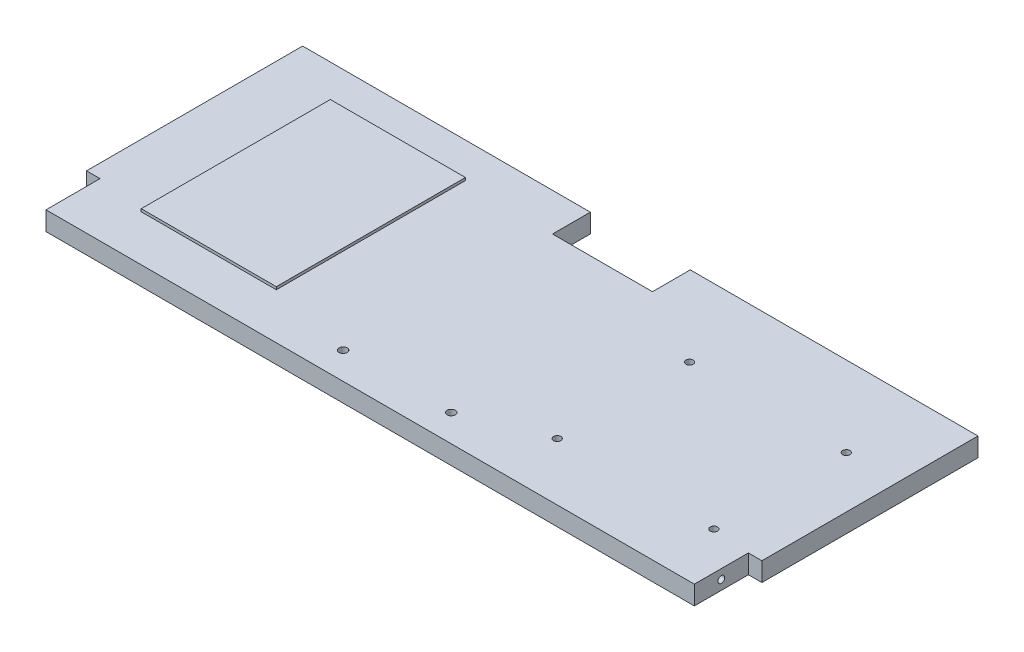
from build123d import *

# Parameters (mm, degrees)
SKIZZE1_W                             = 250
SKIZZE1_H                             = 250
AUFSATZ_LINEAR_AUSTRAGEN1_DEPTH       = 5
SKIZZE2_W                             = 40
SKIZZE2_H                             = 40
AUFSATZ_LINEAR_AUSTRAGEN2_DEPTH       = 15
SKIZZE3_R                             = 1.65
SKIZZE3_W                             = 30
SKIZZE3_H                             = 30
SCHNITT_LINEAR_AUSTRAGEN1_DEPTH       = 15
SKIZZE4_R                             = 1.65
SKIZZE4_W                             = 30
SKIZZE4_H                             = 30
SCHNITT_LINEAR_AUSTRAGEN2_DEPTH       = 15
SKIZZE6_W                             = 40
SKIZZE6_H                             = 40
AUFSATZ_LINEAR_AUSTRAGEN3_DEPTH       = 5
SKIZZE7_W                             = 40
SKIZZE7_H                             = 40
SCHNITT_LINEAR_AUSTRAGEN3_DEPTH       = 43
SKIZZE8_W                             = 30
SKIZZE8_H                             = 30
AUFSATZ_LINEAR_AUSTRAGEN4_DEPTH       = 5
SKIZZE9_W                             = 45
SKIZZE9_H                             = 45
AUFSATZ_LINEAR_AUSTRAGEN5_DEPTH       = 15
SKIZZE10_W                            = 8
SKIZZE10_H                            = 8
AUFSATZ_LINEAR_AUSTRAGEN6_DEPTH       = 34
SKIZZE11_R                            = 2.15
SCHNITT_LINEAR_AUSTRAGEN4_DEPTH       = 34
SKIZZE12_W                            = 143.062860871
SKIZZE12_H                            = 184.486429343
SCHNITT_LINEAR_AUSTRAGEN5_DEPTH       = 60
SKIZZE13_W                            = 45
SKIZZE13_H                            = 45
AUFSATZ_LINEAR_AUSTRAGEN7_DEPTH       = 15
SKIZZE14_W                            = 8
SKIZZE14_H                            = 8
AUFSATZ_LINEAR_AUSTRAGEN8_DEPTH       = 34
SKIZZE15_W                            = 37
SKIZZE15_H                            = 14
SCHNITT_LINEAR_AUSTRAGEN6_DEPTH       = 10
SKIZZE16_W                            = 50
SKIZZE16_H                            = 70
AUFSATZ_LINEAR_AUSTRAGEN9_DEPTH       = 1
SKIZZE17_R                            = 1.35
SCHNITT_LINEAR_AUSTRAGEN7_DEPTH       = 21
SKIZZE18_R                            = 2.15
SCHNITT_LINEAR_AUSTRAGEN8_DEPTH       = 21
SKIZZE19_R                            = 2.15
SCHNITT_LINEAR_AUSTRAGEN9_DEPTH       = 21
SCHNITT_LINEAR_AUSTRAGEN10_DEPTH      = 35
SCHNITT_LINEAR_AUSTRAGEN10_DEPTH_BACK = 36
SKIZZE20_W                            = 250
SKIZZE20_H                            = 150
SKIZZE21_W                            = 5
SKIZZE21_H                            = 20
SCHNITT_LINEAR_AUSTRAGEN11_DEPTH      = 10
SKIZZE22_R                            = 1.25
SCHNITT_LINEAR_AUSTRAGEN13_DEPTH      = 20
SCHNITT_LINEAR_START                  = -20
SKIZZE25_R                            = 1.25
SCHNITT_LINEAR_AUSTRAGEN14_DEPTH      = 20
SKIZZE26_R                            = 1.5
SCHNITT_LINEAR_AUSTRAGEN15_DEPTH      = 10
SKIZZE28_R                            = 1.35
SKIZZE28_R_2                          = 1.5
AUFSATZ_LINEAR_AUSTRAGEN10_DEPTH      = 2


with BuildPart() as part:
    # Skizze1 → Aufsatz-Linear austragen1 (new body)
    with BuildSketch(Plane(origin=(0, 0, 0), x_dir=(1, 0, 0), z_dir=(0, 1, 0))):
        Rectangle(SKIZZE1_W, SKIZZE1_H)
    extrude(amount=AUFSATZ_LINEAR_AUSTRAGEN1_DEPTH)

    # Skizze2 → Aufsatz-Linear austragen2 (add)
    with BuildSketch(Plane(origin=(0, 5, 0), x_dir=(1, 0, 0), z_dir=(0, 1, 0))):
        Polygon((-100.127507589, -114.480956566), (-112.127507589, -114.480956566), (-112.127507589, -92.480956566), (-120.127507589, -92.480956566), (-120.127507589, -122.480956566), (-100.127507589, -122.480956566), align=None)
        Polygon((-66.127507589, -114.480956566), (-78.127507589, -114.480956566), (-78.127507589, -122.480956566), (-58.127507589, -122.480956566), (-58.127507589, -92.480956566), (-66.127507589, -92.480956566), align=None)
        Polygon((-66.127507589, -3.480956566), (-66.127507589, -25.480956566), (-58.127507589, -25.480956566), (-58.127507589, 4.519043434), (-78.127507589, 4.519043434), (-78.127507589, -3.480956566), align=None)
        Polygon((-120.127507589, -25.480956566), (-112.127507589, -25.480956566), (-112.127507589, -3.480956566), (-100.127507589, -3.480956566), (-100.127507589, 4.519043434), (-120.127507589, 4.519043434), align=None)
        with Locations((0, -85)):
            Rectangle(SKIZZE2_W, SKIZZE2_H)
        with Locations((85, 0)):
            Rectangle(SKIZZE2_W, SKIZZE2_H)
    extrude(amount=AUFSATZ_LINEAR_AUSTRAGEN2_DEPTH)

    # Skizze3 → Schnitt-Linear austragen1 (cut)
    with BuildSketch(Plane(origin=(0, 20, 0), x_dir=(1, 0, 0), z_dir=(0, 1, 0))):
        Circle(SKIZZE3_R)
        with Locations((85, 0)):
            Rectangle(SKIZZE3_W, SKIZZE3_H)
        with Locations((0, -85)):
            Rectangle(SKIZZE3_W, SKIZZE3_H)
    extrude(amount=-SCHNITT_LINEAR_AUSTRAGEN1_DEPTH, mode=Mode.SUBTRACT)

    # Skizze4 → Schnitt-Linear austragen2 (cut)
    with BuildSketch(Plane(origin=(0, 5, 0), x_dir=(1, 0, 0), z_dir=(0, 1, 0))):
        with Locations(Location((0, 0, 0), (0, 0, 270))):
            Circle(SKIZZE4_R)
        with Locations((0, -85)):
            Rectangle(SKIZZE4_W, SKIZZE4_H)
        with Locations((85, 0)):
            Rectangle(SKIZZE4_W, SKIZZE4_H)
    extrude(amount=-SCHNITT_LINEAR_AUSTRAGEN2_DEPTH, mode=Mode.SUBTRACT)

    # Skizze6 → Aufsatz-Linear austragen3 (add)
    with BuildSketch(Plane(origin=(0, 20, 0), x_dir=(1, 0, 0), z_dir=(0, 1, 0))):
        with Locations((0, -85)):
            Rectangle(SKIZZE6_W, SKIZZE6_H)
        with Locations((85, 0)):
            Rectangle(SKIZZE6_W, SKIZZE6_H)
    extrude(amount=-AUFSATZ_LINEAR_AUSTRAGEN3_DEPTH)

    # Skizze7 → Schnitt-Linear austragen3 (cut)
    with BuildSketch(Plane(origin=(0, 5, 0), x_dir=(1, 0, 0), z_dir=(0, 1, 0))):
        with Locations((0, -85)):
            Rectangle(SKIZZE7_W, SKIZZE7_H)
        with Locations((85, 0)):
            Rectangle(SKIZZE7_W, SKIZZE7_H)
    extrude(amount=SCHNITT_LINEAR_AUSTRAGEN3_DEPTH, mode=Mode.SUBTRACT)

    # Skizze8 → Aufsatz-Linear austragen4 (add)
    with BuildSketch(Plane(origin=(0, 5, 0), x_dir=(1, 0, 0), z_dir=(0, 1, 0))):
        with Locations((0, -85)):
            Rectangle(SKIZZE8_W, SKIZZE8_H)
        with Locations((85, 0)):
            Rectangle(SKIZZE8_W, SKIZZE8_H)
    extrude(amount=-AUFSATZ_LINEAR_AUSTRAGEN4_DEPTH)

    # Skizze9 → Aufsatz-Linear austragen5 (add)
    with BuildSketch(Plane(origin=(0, 5, 0), x_dir=(1, 0, 0), z_dir=(0, 1, 0))):
        with Locations((16.5, -93.5)):
            Rectangle(SKIZZE9_W, SKIZZE9_H)
        with Locations((93.5, -16.5)):
            Rectangle(SKIZZE9_W, SKIZZE9_H)
    extrude(amount=AUFSATZ_LINEAR_AUSTRAGEN5_DEPTH)

    # Skizze10 → Aufsatz-Linear austragen6 (add)
    with BuildSketch(Plane(origin=(0, 5, 0), x_dir=(1, 0, 0), z_dir=(0, 1, 0))):
        with Locations((-10, -89)):
            Rectangle(SKIZZE10_W, SKIZZE10_H)
        with Locations((43, -89)):
            Rectangle(SKIZZE10_W, SKIZZE10_H)
        with Locations((89, 10)):
            Rectangle(SKIZZE10_W, SKIZZE10_H)
        with Locations((89, -43)):
            Rectangle(SKIZZE10_W, SKIZZE10_H)
    extrude(amount=AUFSATZ_LINEAR_AUSTRAGEN6_DEPTH)

    # Skizze11 → Schnitt-Linear austragen4 (cut)
    with BuildSketch(Plane(origin=(0, 0, 85), x_dir=(-1, 0, 0), z_dir=(0, 0, -1))):
        with Locations((10.85, 34.05)):
            Circle(SKIZZE11_R)
        with Locations((10.85, 24.35)):
            Circle(SKIZZE11_R)
        with Locations((-43.85, 34.05)):
            Circle(SKIZZE11_R)
        with Locations((-43.85, 24.35)):
            Circle(SKIZZE11_R)
    extrude(amount=-SCHNITT_LINEAR_AUSTRAGEN4_DEPTH, mode=Mode.SUBTRACT)

    # Skizze12 → Schnitt-Linear austragen5 (cut)
    with BuildSketch(Plane(origin=(0, 5, 0), x_dir=(1, 0, 0), z_dir=(0, 1, 0))):
        with Locations((48.924998025, -26.491593456)):
            Rectangle(SKIZZE12_W, SKIZZE12_H)
    extrude(amount=SCHNITT_LINEAR_AUSTRAGEN5_DEPTH, mode=Mode.SUBTRACT)

    # Skizze13 → Aufsatz-Linear austragen7 (add)
    with BuildSketch(Plane(origin=(0, 5, 0), x_dir=(1, 0, 0), z_dir=(0, 1, 0))):
        with Locations((16.5, -96.5)):
            Rectangle(SKIZZE13_W, SKIZZE13_H)
        with Locations((96.5, -16.5)):
            Rectangle(SKIZZE13_W, SKIZZE13_H)
    extrude(amount=AUFSATZ_LINEAR_AUSTRAGEN7_DEPTH)

    # Skizze14 → Aufsatz-Linear austragen8 (add)
    with BuildSketch(Plane(origin=(0, 5, 0), x_dir=(1, 0, 0), z_dir=(0, 1, 0))):
        with Locations((-10, -91)):
            Rectangle(SKIZZE14_W, SKIZZE14_H)
        with Locations((43, -91)):
            Rectangle(SKIZZE14_W, SKIZZE14_H)
        with Locations((91, -43)):
            Rectangle(SKIZZE14_W, SKIZZE14_H)
        with Locations((91, 10)):
            Rectangle(SKIZZE14_W, SKIZZE14_H)
    extrude(amount=AUFSATZ_LINEAR_AUSTRAGEN8_DEPTH)

    # Skizze15 → Schnitt-Linear austragen6 (cut)
    with BuildSketch(Plane(origin=(0, 5, 0), x_dir=(1, 0, 0), z_dir=(0, 1, 0))):
        with Locations((0, 118)):
            Rectangle(SKIZZE15_W, SKIZZE15_H)
    extrude(amount=-SCHNITT_LINEAR_AUSTRAGEN6_DEPTH, mode=Mode.SUBTRACT)

    # Skizze16 → Aufsatz-Linear austragen9 (add)
    with BuildSketch(Plane(origin=(0, 5, 0), x_dir=(1, 0, 0), z_dir=(0, 1, 0))):
        with Locations((-76.733084372, 76.985715353)):
            Rectangle(SKIZZE16_W, SKIZZE16_H)
    extrude(amount=AUFSATZ_LINEAR_AUSTRAGEN9_DEPTH)

    # Skizze17 → Schnitt-Linear austragen7 (cut)
    with BuildSketch(Plane(origin=(0, 5, 0), x_dir=(1, 0, 0), z_dir=(0, 1, 0))):
        with Locations(Location((105.951755746, 46.286528094, 0), (0, 0, 270))):
            Circle(SKIZZE17_R)
        with Locations(Location((105.951755746, 95.286528094, 0), (0, 0, 270))):
            Circle(SKIZZE17_R)
        with Locations(Location((47.951755746, 46.286528094, 0), (0, 0, 270))):
            Circle(SKIZZE17_R)
        with Locations(Location((47.951755746, 95.286528094, 0), (0, 0, 270))):
            Circle(SKIZZE17_R)
    extrude(amount=-SCHNITT_LINEAR_AUSTRAGEN7_DEPTH, mode=Mode.SUBTRACT)

    # Skizze18 → Schnitt-Linear austragen8 (cut)
    with BuildSketch(Plane(origin=(0, 0, 87), x_dir=(-1, 0, 0), z_dir=(0, 0, -1))):
        with Locations((10.85, 34.05)):
            Circle(SKIZZE18_R)
        with Locations((10.85, 24.35)):
            Circle(SKIZZE18_R)
        with Locations((-43.85, 34.05)):
            Circle(SKIZZE18_R)
        with Locations((-43.85, 24.35)):
            Circle(SKIZZE18_R)
    extrude(amount=-SCHNITT_LINEAR_AUSTRAGEN8_DEPTH, mode=Mode.SUBTRACT)

    # Skizze19 → Schnitt-Linear austragen9 (cut)
    with BuildSketch(Plane.ZY.offset(-87)):
        with Locations((43.85, 34.05)):
            Circle(SKIZZE19_R)
        with Locations((43.85, 24.35)):
            Circle(SKIZZE19_R)
        with Locations((-10.85, 34.05)):
            Circle(SKIZZE19_R)
        with Locations((-10.85, 24.35)):
            Circle(SKIZZE19_R)
    extrude(amount=-SCHNITT_LINEAR_AUSTRAGEN9_DEPTH, mode=Mode.SUBTRACT)

    # Skizze20 → Schnitt-Linear austragen10 (cut, two sides: drawn at the far end of the back side and taken through both)
    with BuildSketch(Plane(origin=(0, 5, 0), x_dir=(1, 0, 0), z_dir=(0, 1, 0)).offset(-SCHNITT_LINEAR_AUSTRAGEN10_DEPTH_BACK)):
        with Locations((0, -50)):
            Rectangle(SKIZZE20_W, SKIZZE20_H)
    extrude(amount=SCHNITT_LINEAR_AUSTRAGEN10_DEPTH + SCHNITT_LINEAR_AUSTRAGEN10_DEPTH_BACK, mode=Mode.SUBTRACT)

    # Skizze21 → Schnitt-Linear austragen11 (cut)
    with BuildSketch(Plane(origin=(0, 5, 0), x_dir=(1, 0, 0), z_dir=(0, 1, 0))):
        with Locations((122.5, 35)):
            Rectangle(SKIZZE21_W, SKIZZE21_H)
        with Locations((-122.5, 35)):
            Rectangle(SKIZZE21_W, SKIZZE21_H)
    extrude(amount=-SCHNITT_LINEAR_AUSTRAGEN11_DEPTH, mode=Mode.SUBTRACT)

    # Skizze22 → Schnitt-Linear austragen13 (cut)
    with BuildSketch(Plane.ZY.offset(120)):
        with Locations((-35, 1.5)):
            Circle(SKIZZE22_R)
    extrude(amount=-SCHNITT_LINEAR_AUSTRAGEN13_DEPTH, mode=Mode.SUBTRACT)

    # Skizze25 → Schnitt-Linear austragen14 (cut)
    with BuildSketch(Plane(origin=(120, 0, 0), x_dir=(0, 0, -1), z_dir=(1, 0, 0)).offset(SCHNITT_LINEAR_START)):
        with Locations(Location((35, 1.5, 0), (0, 0, 180))):
            Circle(SKIZZE25_R)
    extrude(amount=SCHNITT_LINEAR_AUSTRAGEN14_DEPTH, mode=Mode.SUBTRACT)

    # Skizze26 → Schnitt-Linear austragen15 (cut)
    with BuildSketch(Plane(origin=(0, 5, 0), x_dir=(1, 0, 0), z_dir=(0, 1, 0))):
        with Locations(Location((-20, 35, 0), (0, 0, 270))):
            Circle(SKIZZE26_R)
        with Locations(Location((20, 35, 0), (0, 0, 270))):
            Circle(SKIZZE26_R)
    extrude(amount=-SCHNITT_LINEAR_AUSTRAGEN15_DEPTH, mode=Mode.SUBTRACT)

    # Skizze28 → Aufsatz-Linear austragen10 (add)
    # profile 1 of 2: a face of its own
    with BuildSketch(Plane(origin=(0, 0, 0), x_dir=(-1, 0, 0), z_dir=(0, -1, 0))):
        with BuildLine():
            Line((-125, 125), (-125, 45))
            Line((-125, 45), (-120, 45))
            Line((-120, 45), (-106.360834546, 45))
            ThreePointArc((-106.360834546, 45), (-106.748701045, 47.376196938), (-104.601755746, 46.286528094))
            ThreePointArc((-104.601755746, 46.286528094), (-104.862086902, 45.489582794), (-105.542676946, 45))
            Line((-105.542676946, 45), (-48.360834546, 45))
            ThreePointArc((-48.360834546, 45), (-48.748701045, 47.376196938), (-46.601755746, 46.286528094))
            ThreePointArc((-46.601755746, 46.286528094), (-46.862086902, 45.489582794), (-47.542676946, 45))
            Line((-47.542676946, 45), (120, 45))
            Line((120, 45), (125, 45))
            Line((125, 45), (125, 125))
            Line((125, 125), (18.5, 125))
            Line((18.5, 125), (18.5, 111))
            Line((18.5, 111), (-18.5, 111))
            Line((-18.5, 111), (-18.5, 125))
            Line((-18.5, 125), (-125, 125))
        make_face()
        with Locations(Location((-105.951755746, 95.286528094, 0), (0, 0, 270))):
            Circle(SKIZZE28_R, mode=Mode.SUBTRACT)
        with Locations(Location((-47.951755746, 95.286528094, 0), (0, 0, 270))):
            Circle(SKIZZE28_R, mode=Mode.SUBTRACT)
    # profile 2 of 2: a face of its own
    with BuildSketch(Plane(origin=(0, 0, 0), x_dir=(-1, 0, 0), z_dir=(0, -1, 0))):
        with BuildLine():
            Line((-106.360834546, 45), (-120, 45))
            Line((-120, 45), (-120, 25))
            Line((-120, 25), (120, 25))
            Line((120, 25), (120, 45))
            Line((120, 45), (-47.542676946, 45))
            ThreePointArc((-47.542676946, 45), (-47.951755746, 44.936528094), (-48.360834546, 45))
            Line((-48.360834546, 45), (-105.542676946, 45))
            ThreePointArc((-105.542676946, 45), (-105.951755746, 44.936528094), (-106.360834546, 45))
        make_face()
        with Locations(Location((-20, 35, 0), (0, 0, 270))):
            Circle(SKIZZE28_R_2, mode=Mode.SUBTRACT)
        with Locations(Location((20, 35, 0), (0, 0, 270))):
            Circle(SKIZZE28_R_2, mode=Mode.SUBTRACT)
    extrude(amount=AUFSATZ_LINEAR_AUSTRAGEN10_DEPTH)


solid = part.part
